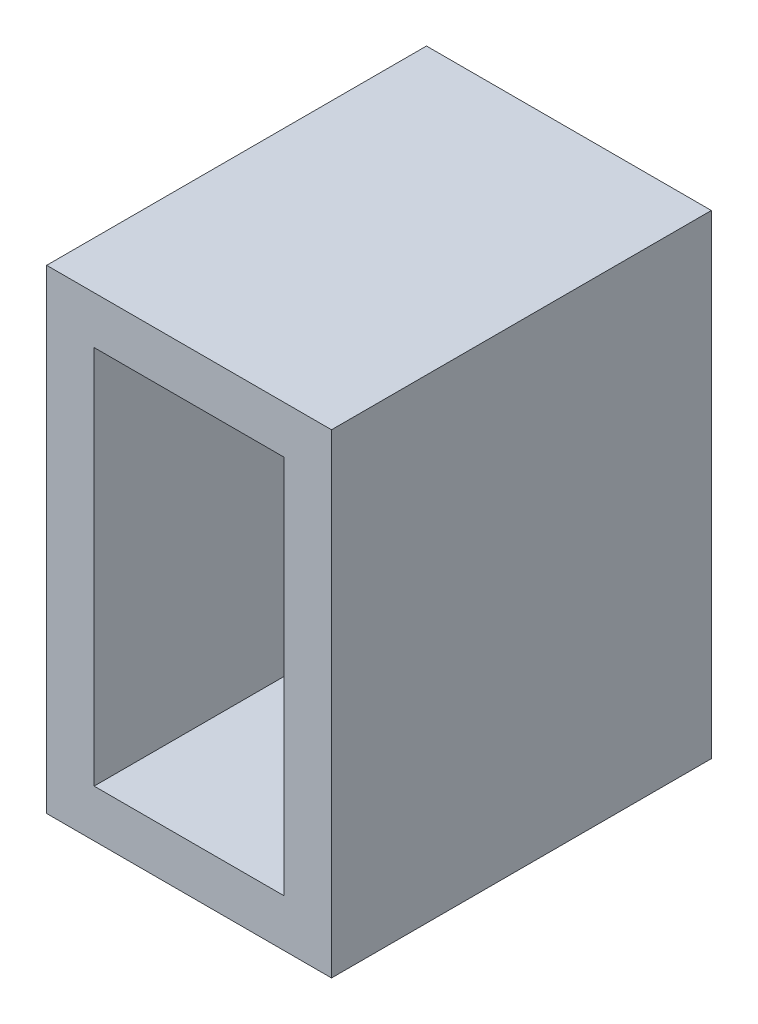
from build123d import *

# Parameters (mm, degrees)
SKETCH1_W           = 38.1
SKETCH1_H           = 63.5
SKETCH1_W_2         = 25.4
SKETCH1_H_2         = 50.8
BOSS_EXTRUDE1_DEPTH = 50.8
SKETCH4_W           = 25.4
SKETCH4_H           = 5.461
SKETCH4_W_2         = 2.921
SKETCH4_H_2         = 39.878
BOSS_EXTRUDE2_DEPTH = 2.54
SKETCH5_W           = 2.921
SKETCH5_H           = 50.8
BOSS_EXTRUDE3_DEPTH = 5.588
SKETCH6_W           = 2.54
SKETCH6_H           = 5.461
CUT_EXTRUDE1_DEPTH  = 2.54


with BuildPart() as part:
    # Sketch1 → Boss-Extrude1 (new body)
    with BuildSketch(Plane.XY):
        with Locations((4.108271787, -2.227658789)):
            Rectangle(SKETCH1_W, SKETCH1_H)
        with Locations((4.108271787, -2.227658789)):
            Rectangle(SKETCH1_W_2, SKETCH1_H_2, mode=Mode.SUBTRACT)
    extrude(amount=BOSS_EXTRUDE1_DEPTH)

    # Sketch4 → Boss-Extrude2 (add)
    with BuildSketch(Plane(origin=(0, 0, 5.588), x_dir=(-1, 0, 0), z_dir=(0, 0, -1))):
        with Locations((-4.108271787, 20.441841211)):
            Rectangle(SKETCH4_W, SKETCH4_H)
        with Locations((-15.347771787, -2.227658789)):
            Rectangle(SKETCH4_W_2, SKETCH4_H_2)
        with Locations((-4.108271787, -24.897158789)):
            Rectangle(SKETCH4_W, SKETCH4_H)
        with Locations((7.131228213, -2.227658789)):
            Rectangle(SKETCH4_W_2, SKETCH4_H_2)
    extrude(amount=-BOSS_EXTRUDE2_DEPTH)

    # Sketch5 → Boss-Extrude3 (add)
    with BuildSketch(Plane(origin=(0, 0, 5.588), x_dir=(-1, 0, 0), z_dir=(0, 0, -1))):
        with Locations((-15.347771787, -2.227658789)):
            Rectangle(SKETCH5_W, SKETCH5_H)
        with Locations((7.131228213, -2.227658789)):
            Rectangle(SKETCH5_W, SKETCH5_H)
    extrude(amount=BOSS_EXTRUDE3_DEPTH)

    # Sketch6 → Cut-Extrude1 (cut)
    with BuildSketch(Plane(origin=(0, 0, 5.588), x_dir=(-1, 0, 0), z_dir=(0, 0, -1))):
        with Locations((-4.108271787, 20.441841211)):
            Rectangle(SKETCH6_W, SKETCH6_H)
        with Locations((-4.108271787, -24.897158789)):
            Rectangle(SKETCH6_W, SKETCH6_H)
    extrude(amount=-CUT_EXTRUDE1_DEPTH, mode=Mode.SUBTRACT)


solid = part.part
